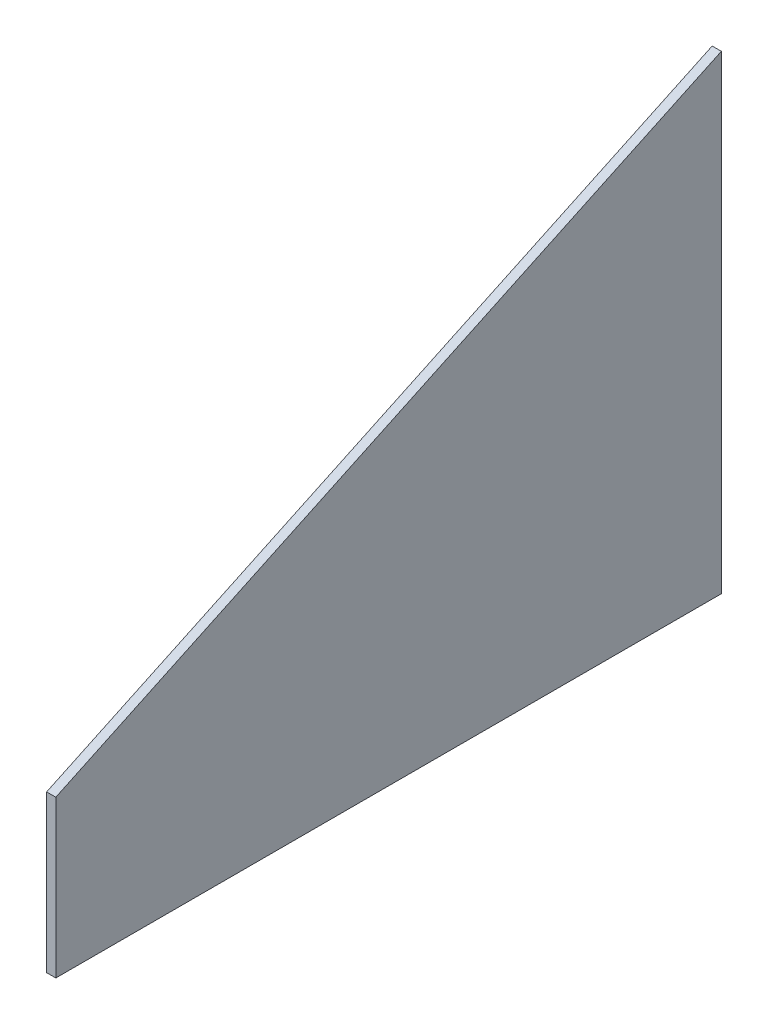
from build123d import *

# Parameters (mm, degrees)
BOSS_EXTRUDE1_DEPTH = 11.90625


with BuildPart() as part:
    # Sketch1 → Boss-Extrude1 (new body)
    with BuildSketch(Plane(origin=(0, 0, 0), x_dir=(0, 0, -1), z_dir=(1, 0, 0))):
        Polygon((0, 0), (863.6, 0), (863.6, 609.6), (0, 203.2), align=None)
    extrude(amount=BOSS_EXTRUDE1_DEPTH)


solid = part.part
